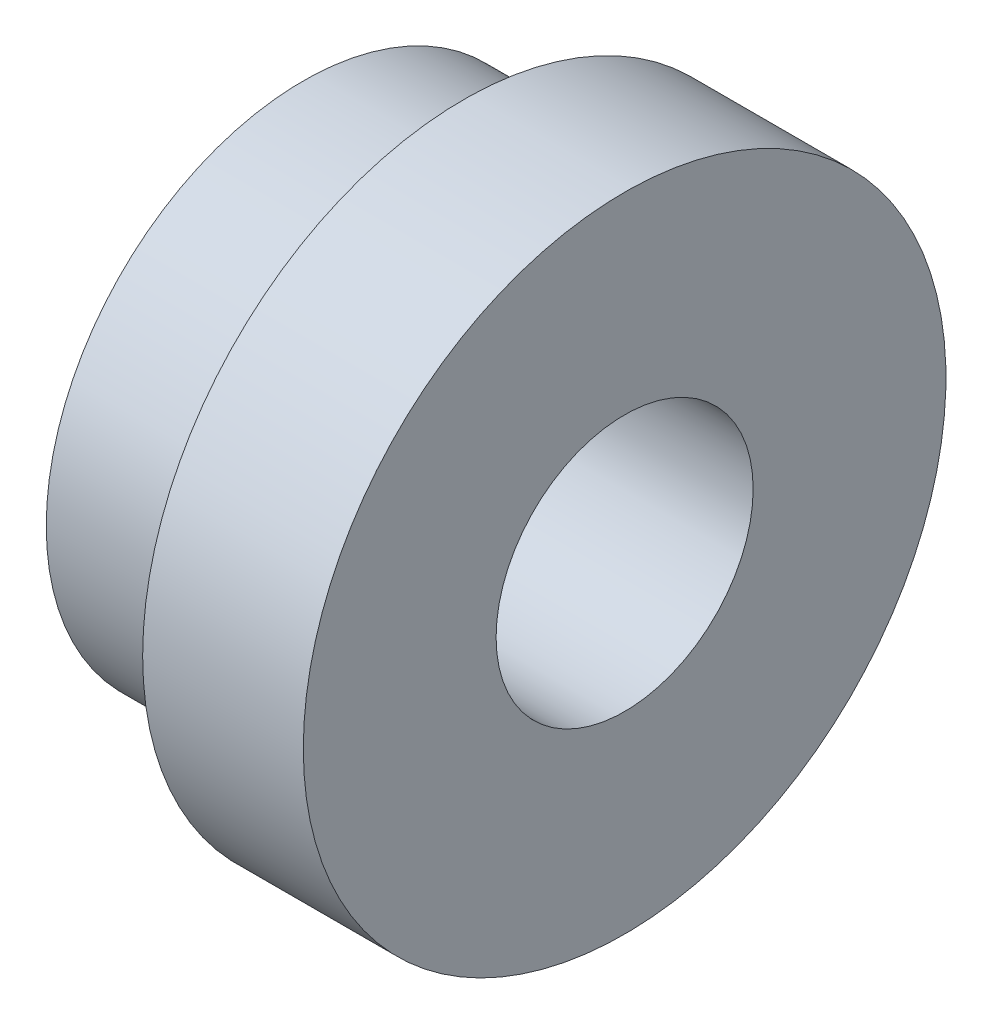
from build123d import *


with BuildPart() as part:
    # Эскиз1 → Повернуть1 (revolve)
    with BuildSketch(Plane.XY, mode=Mode.PRIVATE) as revolve_1_sk:
        Polygon((0, 0.8), (0, 1.6), (1, 1.6), (1, 2), (2, 2), (2, 0.8), align=None)
    revolve(revolve_1_sk.sketch.rotate(Axis((0, 0, 0), (1, 0, 0)), 90), axis=Axis((0, 0, 0), (1, 0, 0)))


solid = part.part
